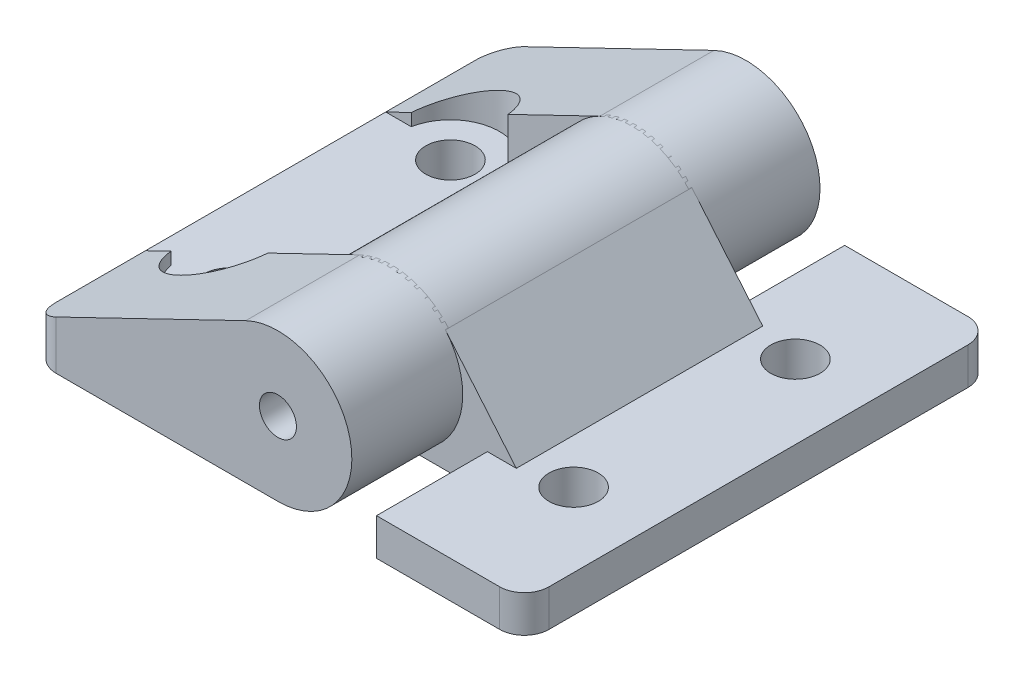
from build123d import *

# Parameters (mm, degrees)
SKETCH_1_R               = 1.5
EXTRUDE_1_DEPTH          = 10
SKETCH_2_W               = 12
SKETCH_2_H               = 38
EXTRUDE_2_DEPTH          = 3
SKETCH_3_R               = 1.5
EXTRUDE_3_DEPTH          = 19
CUT_EXTRUDE_1_DEPTH      = 29.231188427
CUT_EXTRUDE_1_DEPTH_BACK = 29.231188427
SKETCH_4_W               = 13
SKETCH_4_H               = 19.5
CUT_EXTRUDE_START        = -3
CUT_EXTRUDE_2_DEPTH      = 28.083217913
SKETCH_6_R               = 2
CUT_EXTRUDE_3_DEPTH      = 30.017236257
SKETCH_7_R               = 2
CUT_EXTRUDE_4_DEPTH      = 30.017236257
FILLET_1_R               = 2
FILLET_2_R               = 2


with BuildPart() as part:
    # 草图1 → 凸台-拉伸1 (new, symmetric)
    with BuildSketch(Plane.XY):
        with BuildLine():
            Line((0, -6), (20, -6))
            Line((20, -6), (20, -3))
            Line((20, -3), (10.34974263, -3))
            Line((10.34974263, -3), (4.596266659, 3.856725658))
            ThreePointArc((4.596266659, 3.856725658), (-5.437846722, 2.53570957), (0, -6))
        make_face()
        Circle(SKETCH_1_R, mode=Mode.SUBTRACT)
    extrude(amount=EXTRUDE_1_DEPTH, both=True)

    # 草图2 → 凸台-拉伸2 (add)
    with BuildSketch(Plane(origin=(0, -3, 0), x_dir=(1, 0, 0), z_dir=(0, 1, 0))):
        with Locations((14, 0)):
            Rectangle(SKETCH_2_W, SKETCH_2_H)
    extrude(amount=-EXTRUDE_2_DEPTH)

    # 草图7 → 切除-拉伸4 (cut, through all)
    with BuildSketch(Plane(origin=(0, -3, 0), x_dir=(1, 0, 0), z_dir=(0, 1, 0))):
        with Locations(Location((14, 9, 0), (0, 0, 270))):
            Circle(SKETCH_7_R)
        with Locations(Location((14, -9, 0), (0, 0, 90))):
            Circle(SKETCH_7_R)
    extrude(amount=-CUT_EXTRUDE_4_DEPTH, mode=Mode.SUBTRACT)

    # 圆角2
    fillet_2_edges = [part.edges().sort_by_distance(p)[0] for p in [
        (20, -4.5, -19),
        (20, -4.5, 19),
    ]]
    fillet(fillet_2_edges, radius=FILLET_2_R)


with BuildPart() as body_2:
    # 草图3 → 凸台-拉伸3 (new, symmetric)
    with BuildSketch(Plane.XY):
        with BuildLine():
            Line((0, -6), (-20, -6))
            Line((-20, -6), (-20, -3))
            Line((-20, -3), (-2.610361229, 5.40240819))
            ThreePointArc((-2.610361229, 5.40240819), (5.848694262, 1.338945641), (0, -6))
        make_face()
        Circle(SKETCH_3_R, mode=Mode.SUBTRACT)
    extrude(amount=EXTRUDE_3_DEPTH, both=True)

    # 草图4 → 切除-拉伸1 (cut, two sides: drawn at the far end of the back side and taken through both)
    with BuildSketch(Plane(origin=(0, 0, 0), x_dir=(1, 0, 0), z_dir=(0, 1, 0)).offset(-CUT_EXTRUDE_1_DEPTH_BACK)):
        Rectangle(SKETCH_4_W, SKETCH_4_H)
    extrude(amount=CUT_EXTRUDE_1_DEPTH + CUT_EXTRUDE_1_DEPTH_BACK, mode=Mode.SUBTRACT)

    # 草图5 → 切除-拉伸2 (cut, through all)
    with BuildSketch(Plane.XZ.offset(6).offset(CUT_EXTRUDE_START)):
        with BuildLine():
            Line((-33.5, 9.75), (-17.929058411, 9.75))
            ThreePointArc((-17.929058411, 9.75), (-14, 13), (-10.070941589, 9.75))
            Line((-10.070941589, 9.75), (-6.5, 9.75))
            Line((-6.5, 9.75), (-6.5, -9.75))
            Line((-6.5, -9.75), (-10.070941589, -9.75))
            ThreePointArc((-10.070941589, -9.75), (-14, -13), (-17.929058411, -9.75))
            Line((-17.929058411, -9.75), (-33.5, -9.75))
            Line((-33.5, -9.75), (-33.5, 9.75))
        make_face()
    extrude(amount=-CUT_EXTRUDE_2_DEPTH, mode=Mode.SUBTRACT)

    # 草图6 → 切除-拉伸3 (cut, through all)
    with BuildSketch(Plane(origin=(0, -3, 0), x_dir=(1, 0, 0), z_dir=(0, 1, 0))):
        with Locations(Location((-14, 9, 0), (0, 0, 180))):
            Circle(SKETCH_6_R)
        with Locations(Location((-14, -9, 0), (0, 0, 180))):
            Circle(SKETCH_6_R)
    extrude(amount=-CUT_EXTRUDE_3_DEPTH, mode=Mode.SUBTRACT)

    # 圆角1
    fillet_1_edges = [body_2.edges().sort_by_distance(p)[0] for p in [
        (-20, -4.5, 19),
        (-20, -4.5, -19),
    ]]
    fillet(fillet_1_edges, radius=FILLET_1_R)


solid = Compound([part.part, body_2.part])
